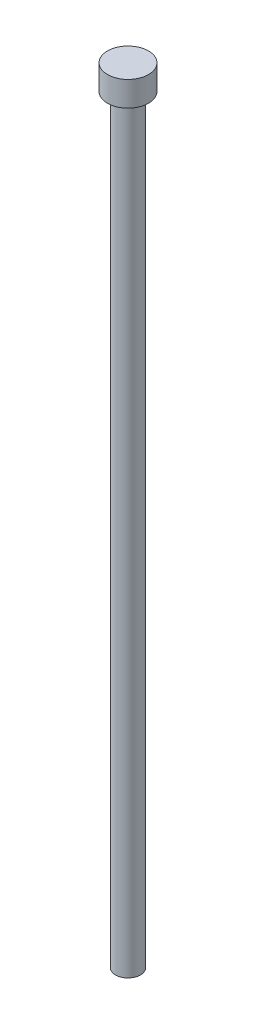
from build123d import *

# Parameters (mm, degrees)
SKETCH1_R           = 3.429
BOSS_EXTRUDE1_DEPTH = 4.1656
SKETCH2_R           = 2.0828
BOSS_EXTRUDE2_DEPTH = 127


with BuildPart() as part:
    # Sketch1 → Boss-Extrude1 (new body)
    with BuildSketch(Plane(origin=(0, 0, 0), x_dir=(1, 0, 0), z_dir=(0, 1, 0))):
        with Locations(Location((0, 0, 0), (0, 0, 270))):
            Circle(SKETCH1_R)
    extrude(amount=BOSS_EXTRUDE1_DEPTH)

    # Sketch2 → Boss-Extrude2 (add)
    with BuildSketch(Plane.XZ):
        with Locations(Location((0, 0, 0), (0, 0, 270))):
            Circle(SKETCH2_R)
    extrude(amount=BOSS_EXTRUDE2_DEPTH)


solid = part.part
